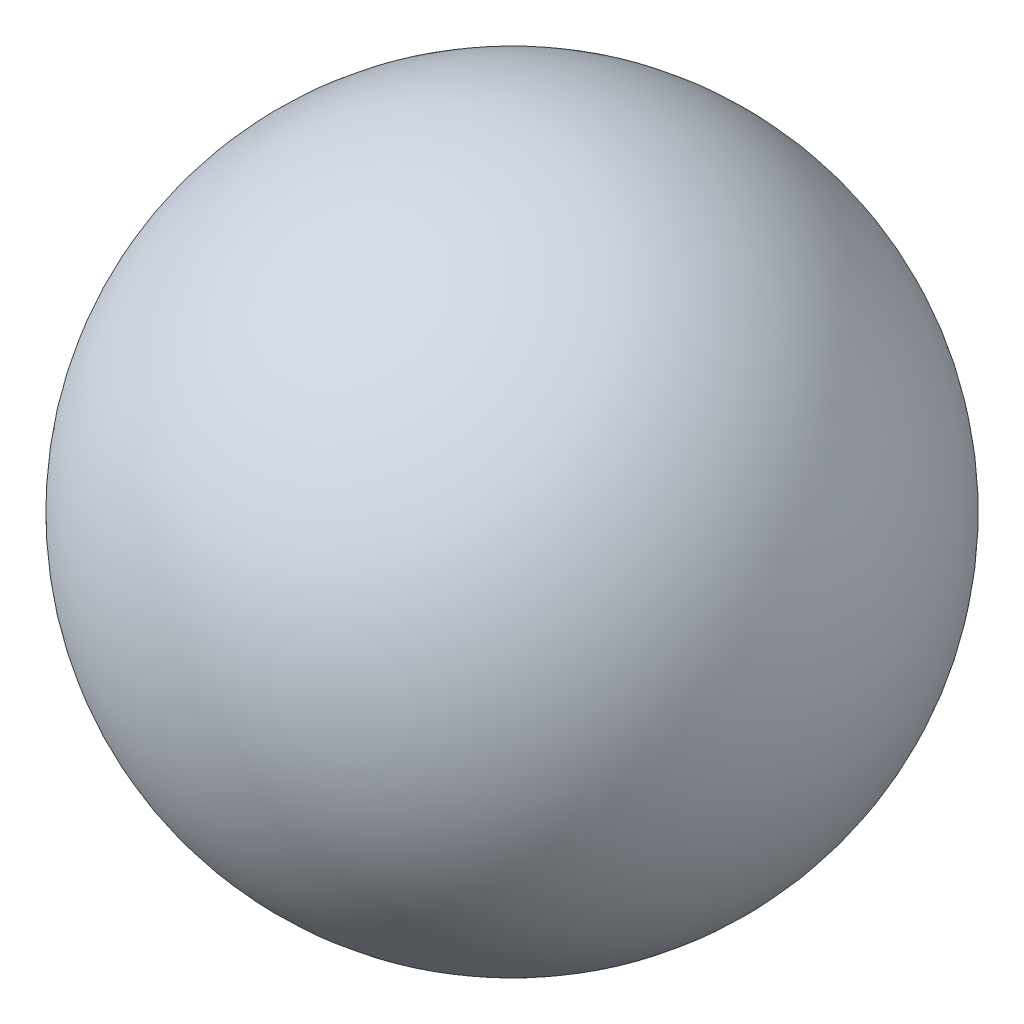
from build123d import *


with BuildPart() as part:
    # Sketch1 → Revolve1 (revolve)
    with BuildSketch(Plane.XY):
        with BuildLine():
            Line((0, 403), (0, 400))
            ThreePointArc((0, 400), (-400, 0), (0, -400))
            Line((0, -400), (0, -403))
            ThreePointArc((0, -403), (-403, 0), (0, 403))
        make_face()
    revolve(axis=Axis((0, 403, 0), (0, -1, 0)))


solid = part.part
